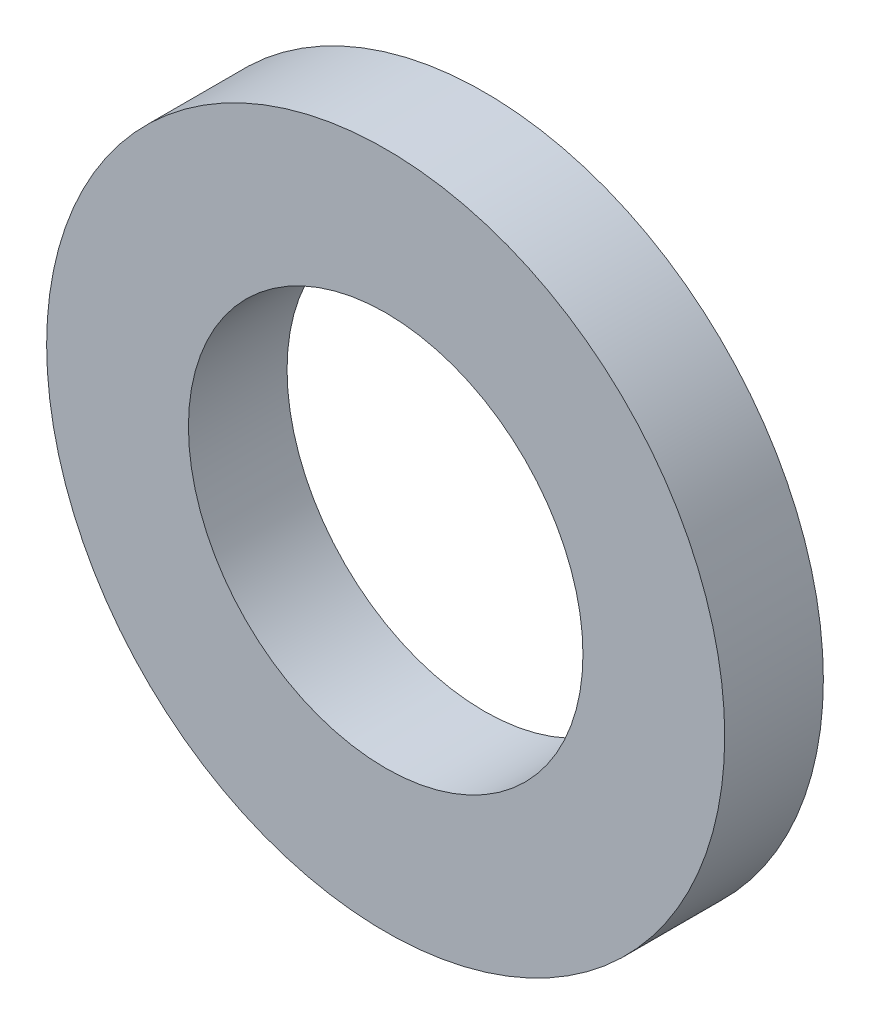
from build123d import *

# Parameters (mm, degrees)
TOP_SKETCH_R            = 5.5
TOP_SKETCH_R_2          = 3.2
EXTRUDE_THICKNESS_DEPTH = 1.6


with BuildPart() as part:
    # Top Sketch → Extrude Thickness (new body)
    with BuildSketch(Plane.XY):
        Circle(TOP_SKETCH_R)
        Circle(TOP_SKETCH_R_2, mode=Mode.SUBTRACT)
    extrude(amount=EXTRUDE_THICKNESS_DEPTH)


solid = part.part
